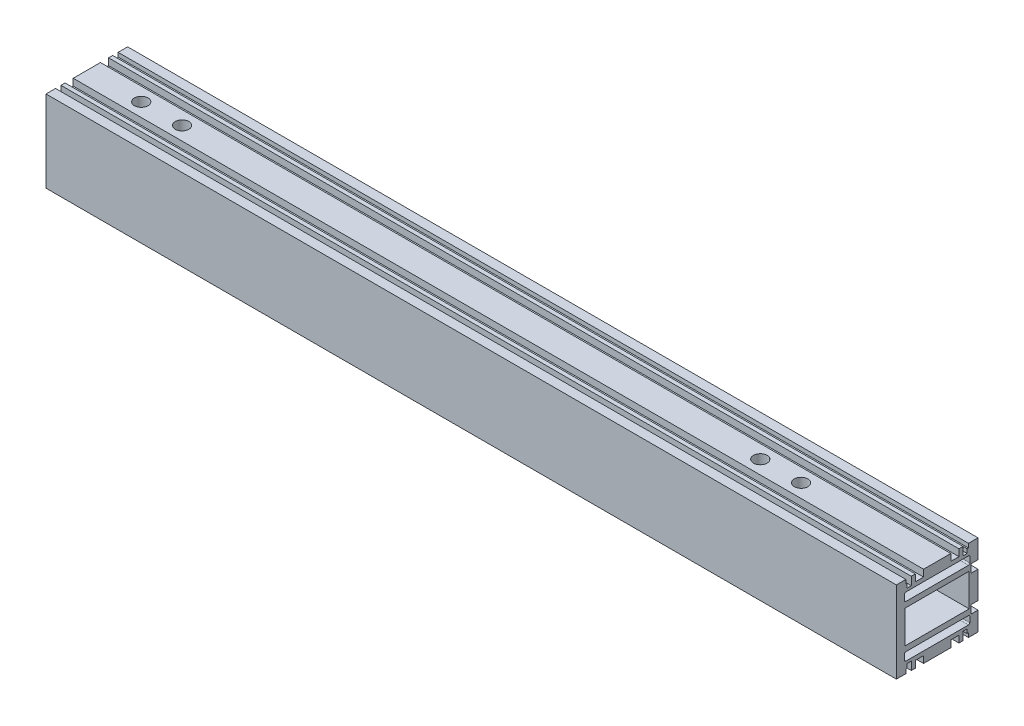
from build123d import *

# Parameters (mm, degrees)
SKETCH_1_W             = 23.5
SKETCH_1_H             = 12
EXTRUDE_1_DEPTH        = 156.25
HOLE_WIZARD_M6_1_D     = 5
HOLE_WIZARD_M6_1_DEPTH = 19
HOLE_WIZARD_M6_1_TIP   = 1.502151548


with BuildPart() as part:
    # 草图1 → 凸台-拉伸1 (new, symmetric)
    with BuildSketch(Plane(origin=(0, 0, 0), x_dir=(0, 0, -1), z_dir=(1, 0, 0))):
        Polygon((-15, 15), (-11.5, 15), (-11.5, 13.5), (-11, 13.5), (-11, 12), (-9.5, 12), (-9.5, 15), (-8, 15), (-8, 12.5), (-5, 12.5), (-5, 15), (5, 15), (5, 12.5), (8, 12.5), (8, 15), (9.5, 15), (9.5, 12), (11, 12), (11, 13.5), (11.5, 13.5), (11.5, 15), (15, 15), (15, 8), (12.5, 8), (12.5, 5), (15, 5), (15, -5), (12.5, -5), (12.5, -8), (15, -8), (15, -15), (11.5, -15), (11.5, -13.5), (11, -13.5), (11, -12), (9.5, -12), (9.5, -15), (8, -15), (8, -12.5), (5, -12.5), (5, -15), (-5, -15), (-5, -12.5), (-8, -12.5), (-8, -15), (-9.5, -15), (-9.5, -12), (-11, -12), (-11, -13.5), (-11.5, -13.5), (-11.5, -15), (-15, -15), align=None)
        with BuildLine():
            Line((12, -10.5), (12, -8.5))
            ThreePointArc((12, -8.5), (11.853553391, -8.146446609), (11.5, -8))
            Line((11.5, -8), (-11.5, -8))
            ThreePointArc((-11.5, -8), (-11.853553391, -8.146446609), (-12, -8.5))
            Line((-12, -8.5), (-12, -10.5))
            ThreePointArc((-12, -10.5), (-11.853553391, -10.853553391), (-11.5, -11))
            Line((-11.5, -11), (11.5, -11))
            ThreePointArc((11.5, -11), (11.853553391, -10.853553391), (12, -10.5))
        make_face(mode=Mode.SUBTRACT)
        with BuildLine():
            Line((-11.5, 11), (11.5, 11))
            ThreePointArc((11.5, 11), (11.853553391, 10.853553391), (12, 10.5))
            Line((12, 10.5), (12, 8.5))
            ThreePointArc((12, 8.5), (11.853553391, 8.146446609), (11.5, 8))
            Line((11.5, 8), (-11.5, 8))
            ThreePointArc((-11.5, 8), (-11.853553391, 8.146446609), (-12, 8.5))
            Line((-12, 8.5), (-12, 10.5))
            ThreePointArc((-12, 10.5), (-11.853553391, 10.853553391), (-11.5, 11))
        make_face(mode=Mode.SUBTRACT)
        Rectangle(SKETCH_1_W, SKETCH_1_H, mode=Mode.SUBTRACT)
    extrude(amount=EXTRUDE_1_DEPTH, both=True)

    # M6 螺纹孔1
    with Locations(Plane(origin=(0, 15, 0), x_dir=(1, 0, 0), z_dir=(0, 1, 0))):
        with Locations((106.25, 0), (91.25, 0), (-121.25, 0), (-136.25, 0)):
            Hole(HOLE_WIZARD_M6_1_D / 2, depth=HOLE_WIZARD_M6_1_DEPTH)
            with Locations((0, 0, -(HOLE_WIZARD_M6_1_DEPTH + HOLE_WIZARD_M6_1_TIP / 2))):  # 118° drill point
                Cone(0, HOLE_WIZARD_M6_1_D / 2, HOLE_WIZARD_M6_1_TIP, mode=Mode.SUBTRACT)


solid = part.part
